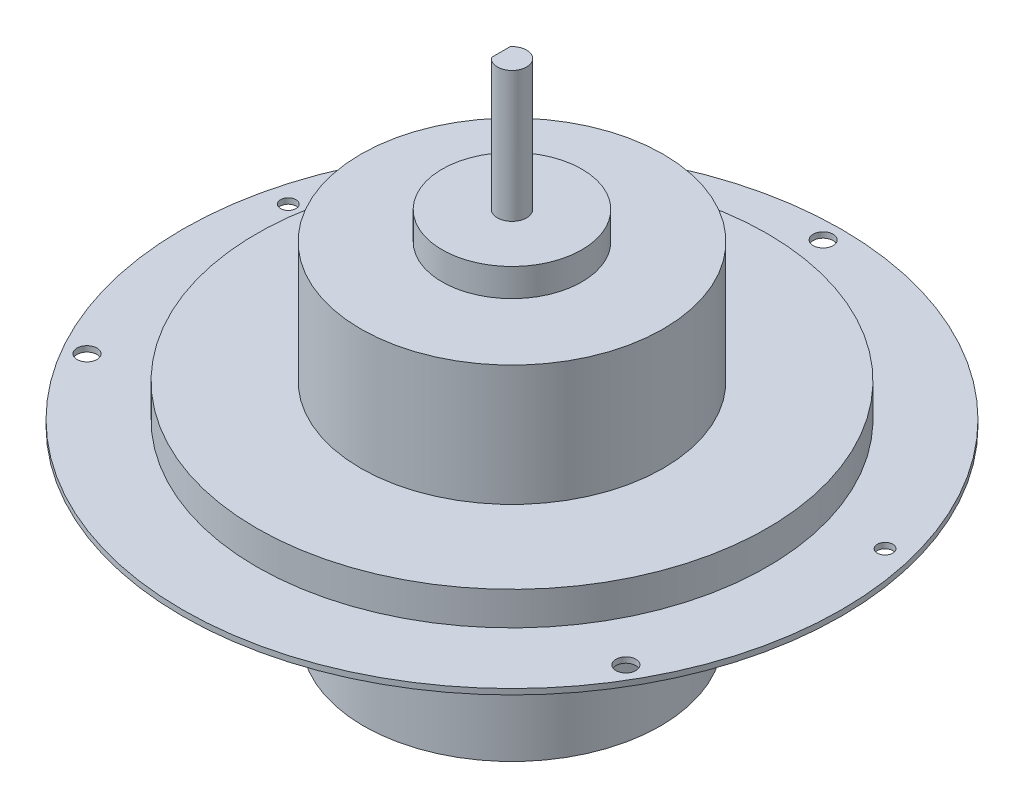
from build123d import *

# Parameters (mm, degrees)
SKETCH1_R           = 90.17
BOSS_EXTRUDE1_DEPTH = 0.762
SKETCH2_R           = 69.85
BOSS_EXTRUDE2_DEPTH = 9.144
SKETCH3_R           = 41.402
BOSS_EXTRUDE3_DEPTH = 33.02
SKETCH4_R           = 19.1262
BOSS_EXTRUDE4_DEPTH = 7.62
SKETCH5_R           = 4.0005
BOSS_EXTRUDE5_DEPTH = 35.7632
CUT_EXTRUDE1_DEPTH  = 24.4602
SKETCH7_R           = 2.7178
CUT_EXTRUDE2_DEPTH  = 6.35
SKETCH8_R           = 2.1209
CUT_EXTRUDE3_DEPTH  = 6.35
SKETCH9_R           = 40.64
BOSS_EXTRUDE6_DEPTH = 50.8


with BuildPart() as part:
    # Sketch1 → Boss-Extrude1 (new, symmetric)
    with BuildSketch(Plane(origin=(0, 0, 0), x_dir=(1, 0, 0), z_dir=(0, 1, 0))):
        with Locations(Location((0, 0, 0), (0, 0, 90))):
            Circle(SKETCH1_R)
    extrude(amount=BOSS_EXTRUDE1_DEPTH, both=True)

    # Sketch2 → Boss-Extrude2 (add)
    with BuildSketch(Plane(origin=(0, 0.762, 0), x_dir=(1, 0, 0), z_dir=(0, 1, 0))):
        with Locations(Location((0, 0, 0), (0, 0, 270))):
            Circle(SKETCH2_R)
    extrude(amount=BOSS_EXTRUDE2_DEPTH)

    # Sketch3 → Boss-Extrude3 (add)
    with BuildSketch(Plane(origin=(0, 9.906, 0), x_dir=(1, 0, 0), z_dir=(0, 1, 0))):
        with Locations(Location((0, 0, 0), (0, 0, 270))):
            Circle(SKETCH3_R)
    extrude(amount=BOSS_EXTRUDE3_DEPTH)

    # Sketch4 → Boss-Extrude4 (add)
    with BuildSketch(Plane(origin=(0, 42.926, 0), x_dir=(1, 0, 0), z_dir=(0, 1, 0))):
        with Locations(Location((0, 0, 0), (0, 0, 90))):
            Circle(SKETCH4_R)
    extrude(amount=BOSS_EXTRUDE4_DEPTH)

    # Sketch5 → Boss-Extrude5 (add)
    with BuildSketch(Plane(origin=(0, 50.546, 0), x_dir=(1, 0, 0), z_dir=(0, 1, 0))):
        with Locations(Location((0, 0, 0), (0, 0, 270))):
            Circle(SKETCH5_R)
    extrude(amount=BOSS_EXTRUDE5_DEPTH)

    # Sketch6 → Cut-Extrude1 (cut)
    with BuildSketch(Plane(origin=(0, 86.3092, 0), x_dir=(1, 0, 0), z_dir=(0, 1, 0))):
        with BuildLine():
            Line((-3.0734, -2.6797), (-3.0734, 2.6797))
            ThreePointArc((-3.0734, 2.6797), (-4.077570312, 0), (-3.0734, -2.6797))
        make_face()
    extrude(amount=-CUT_EXTRUDE1_DEPTH, mode=Mode.SUBTRACT)

    # Sketch7 → Cut-Extrude2 (cut)
    with BuildSketch(Plane(origin=(0, 0.762, 0), x_dir=(1, 0, 0), z_dir=(0, 1, 0))):
        with Locations(Location((0, 85.1408, 0), (0, 0, 270))):
            Circle(SKETCH7_R)
        with Locations(Location((73.734095699, -42.5704, 0), (0, 0, 270))):
            Circle(SKETCH7_R)
        with Locations(Location((-73.734095699, -42.5704, 0), (0, 0, 270))):
            Circle(SKETCH7_R)
    extrude(amount=-CUT_EXTRUDE2_DEPTH, mode=Mode.SUBTRACT)

    # Sketch8 → Cut-Extrude3 (cut)
    with BuildSketch(Plane(origin=(0, 0.762, 0), x_dir=(1, 0, 0), z_dir=(0, 1, 0))):
        with Locations(Location((-81.657901206, 20.433276927, 0), (0, 0, 270))):
            Circle(SKETCH8_R)
        with Locations(Location((81.657901206, 20.433276927, 0), (0, 0, 270))):
            Circle(SKETCH8_R)
    extrude(amount=-CUT_EXTRUDE3_DEPTH, mode=Mode.SUBTRACT)

    # Sketch9 → Boss-Extrude6 (add)
    with BuildSketch(Plane.XZ.offset(0.762)):
        with Locations(Location((0, 0, 0), (0, 0, 90))):
            Circle(SKETCH9_R)
    extrude(amount=BOSS_EXTRUDE6_DEPTH)


solid = part.part
